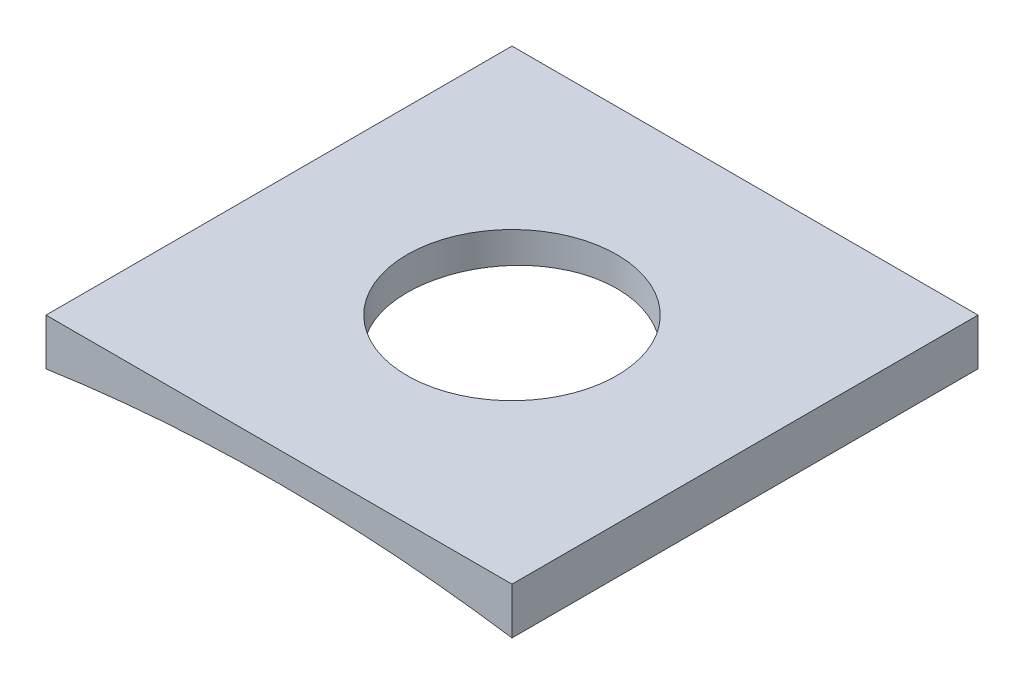
from build123d import *

# Parameters (mm, degrees)
BOSS_EXTRUDE1_DEPTH = 5
SKETCH2_R           = 2.25
CUT_EXTRUDE1_DEPTH  = 8.141428429


with BuildPart() as part:
    # Sketch1 → Boss-Extrude1 (new, symmetric)
    with BuildSketch(Plane.XY):
        with BuildLine():
            Line((-5, 0), (5, 0))
            Line((5, 0), (5, -1))
            ThreePointArc((5, -1), (0, -0.631439341), (-5, -1))
            Line((-5, -1), (-5, 0))
        make_face()
    extrude(amount=BOSS_EXTRUDE1_DEPTH, both=True)

    # Sketch2 → Cut-Extrude1 (cut, through all)
    with BuildSketch(Plane(origin=(0, 0, 0), x_dir=(1, 0, 0), z_dir=(0, 1, 0))):
        with Locations(Location((0, 0, 0), (0, 0, 180))):
            Circle(SKETCH2_R)
    extrude(amount=-CUT_EXTRUDE1_DEPTH, mode=Mode.SUBTRACT)


solid = part.part
